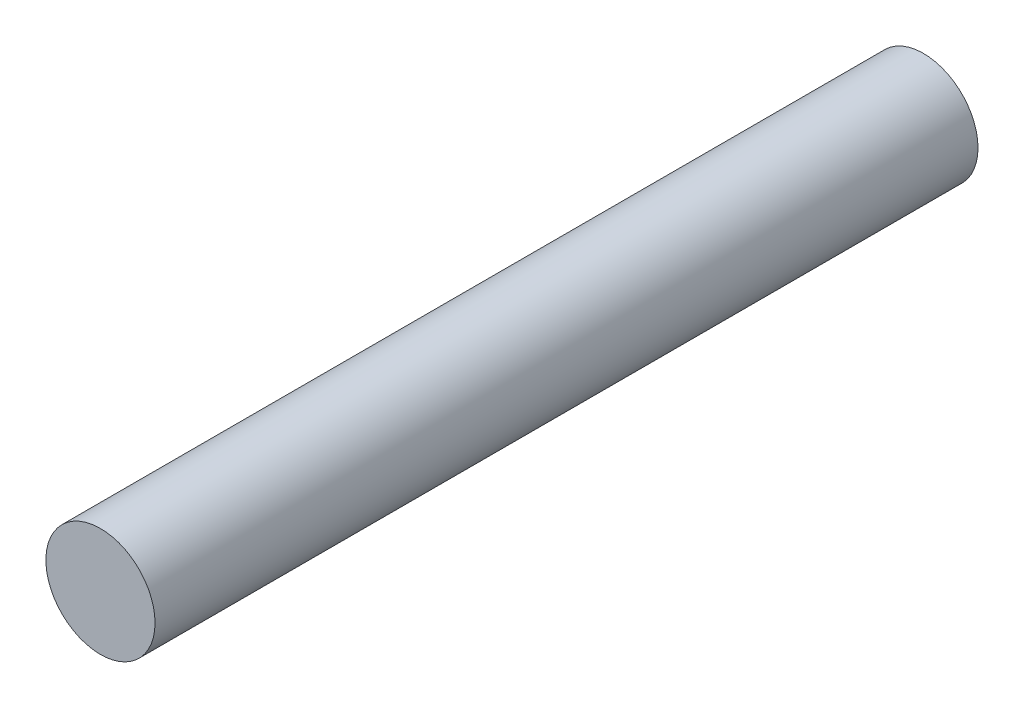
from build123d import *

# Parameters (mm, degrees)
CROQUIS1_R              = 4
SALIENTE_EXTRUIR1_DEPTH = 60.325


with BuildPart() as part:
    # Croquis1 → Saliente-Extruir1 (new body)
    with BuildSketch(Plane.XY):
        Circle(CROQUIS1_R)
    extrude(amount=SALIENTE_EXTRUIR1_DEPTH)


solid = part.part
